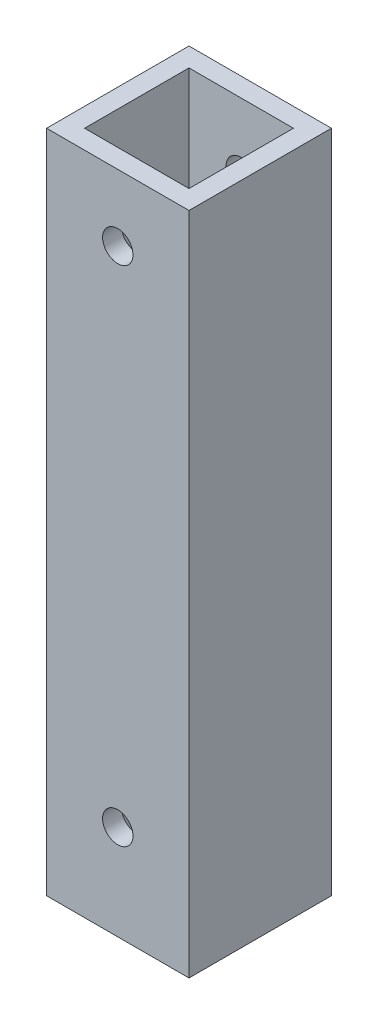
from build123d import *

# Parameters (mm, degrees)
SKETCH1_W           = 15
SKETCH1_H           = 15
SKETCH1_W_2         = 11
SKETCH1_H_2         = 11
BOSS_EXTRUDE1_DEPTH = 70
SKETCH2_R           = 1.6
CUT_EXTRUDE1_DEPTH  = 74.143694192


with BuildPart() as part:
    # Sketch1 → Boss-Extrude1 (new body)
    with BuildSketch(Plane(origin=(0, 0, 0), x_dir=(1, 0, 0), z_dir=(0, 1, 0))):
        with Locations((7.5, 7.5)):
            Rectangle(SKETCH1_W, SKETCH1_H)
        with Locations((7.5, 7.5)):
            Rectangle(SKETCH1_W_2, SKETCH1_H_2, mode=Mode.SUBTRACT)
    extrude(amount=BOSS_EXTRUDE1_DEPTH)

    # Sketch2 → Cut-Extrude1 (cut, through all)
    with BuildSketch(Plane(origin=(0, 0, -15), x_dir=(-1, 0, 0), z_dir=(0, 0, -1))):
        with Locations((-7.5, 63)):
            Circle(SKETCH2_R)
        with Locations((-7.5, 10)):
            Circle(SKETCH2_R)
    extrude(amount=-CUT_EXTRUDE1_DEPTH, mode=Mode.SUBTRACT)


solid = part.part
